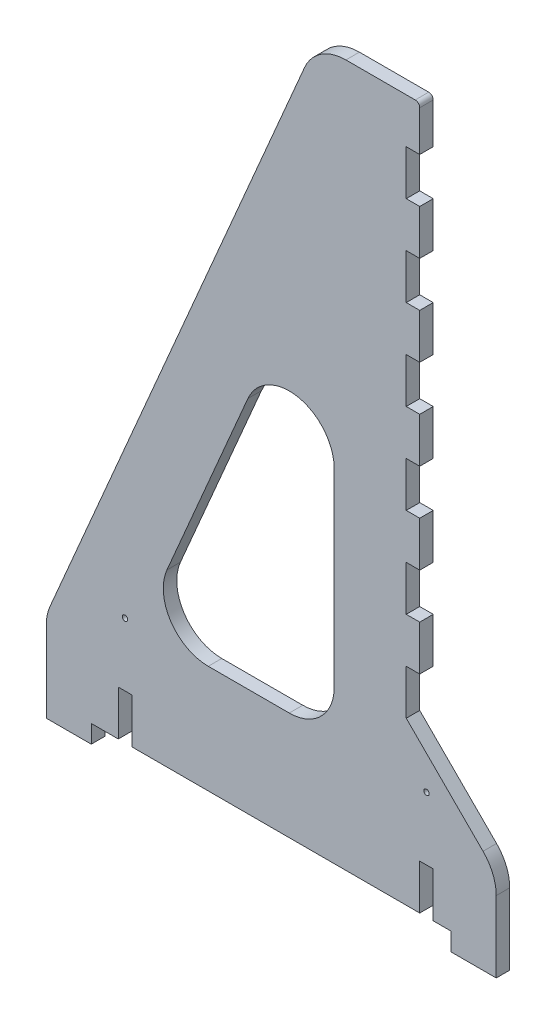
from build123d import *
from OCP.BRepFilletAPI import BRepFilletAPI_MakeFillet

# Parameters (mm, degrees)
ESQUISSE1_R        = 3
BOSS_EXTRU_1_DEPTH = 15
CONG_1_R1          = 50
CONG_1_R2          = 5


with BuildPart() as part:
    # Esquisse1 → Boss.-Extru.1 (new body)
    with BuildSketch(Plane.XY):
        Polygon((-450, 0), (-450, 20), (-420, 20), (-420, 70), (-405, 70), (-405, 20), (-85, 20), (-85, 70), (-70, 70), (-70, 20), (-50, 20), (-50, 0), (0, 0), (0, 100), (-100, 200), (-100, 250), (-85, 250), (-85, 300), (-100, 300), (-100, 350), (-85, 350), (-85, 400), (-100, 400), (-100, 450), (-85, 450), (-85, 500), (-100, 500), (-100, 550), (-85, 550), (-85, 600), (-100, 600), (-100, 650), (-85, 650), (-85, 700), (-100, 700), (-100, 750), (-85, 750), (-85, 800), (-100, 800), (-200, 800), (-500, 100), (-500, 0), align=None)
        with Locations((-412.5, 140)):
            Circle(ESQUISSE1_R, mode=Mode.SUBTRACT)
        with Locations((-77.5, 140)):
            Circle(ESQUISSE1_R, mode=Mode.SUBTRACT)
        Polygon((-180, 643.579383844), (-180, 140), (-395.819735933, 140), align=None, mode=Mode.SUBTRACT)
    extrude(amount=BOSS_EXTRU_1_DEPTH)

    # Congé1: one fillet with a radius per group of edges: ONE call of the kernel's fillet builder (fillet() takes one radius for all edges)
    cong_1_edges_1 = [part.edges().sort_by_distance(p)[0] for p in [
        (-200, 800, 7.5),
        (-180, 643.579383844, 7.5),
        (-395.819735933, 140, 7.5),
        (-180, 140, 7.5),
        (0, 100, 7.5),
        (-500, 100, 7.5),
    ]]
    cong_1_edges_2 = [part.edges().sort_by_distance(p)[0] for p in [
        (-85, 800, 7.5),
    ]]
    cong_1 = BRepFilletAPI_MakeFillet(part.part.solid().wrapped)
    for e in cong_1_edges_1:
        cong_1.Add(CONG_1_R1, e.wrapped)
    for e in cong_1_edges_2:
        cong_1.Add(CONG_1_R2, e.wrapped)
    add(Compound.cast(cong_1.Shape()), mode=Mode.REPLACE)


solid = part.part
